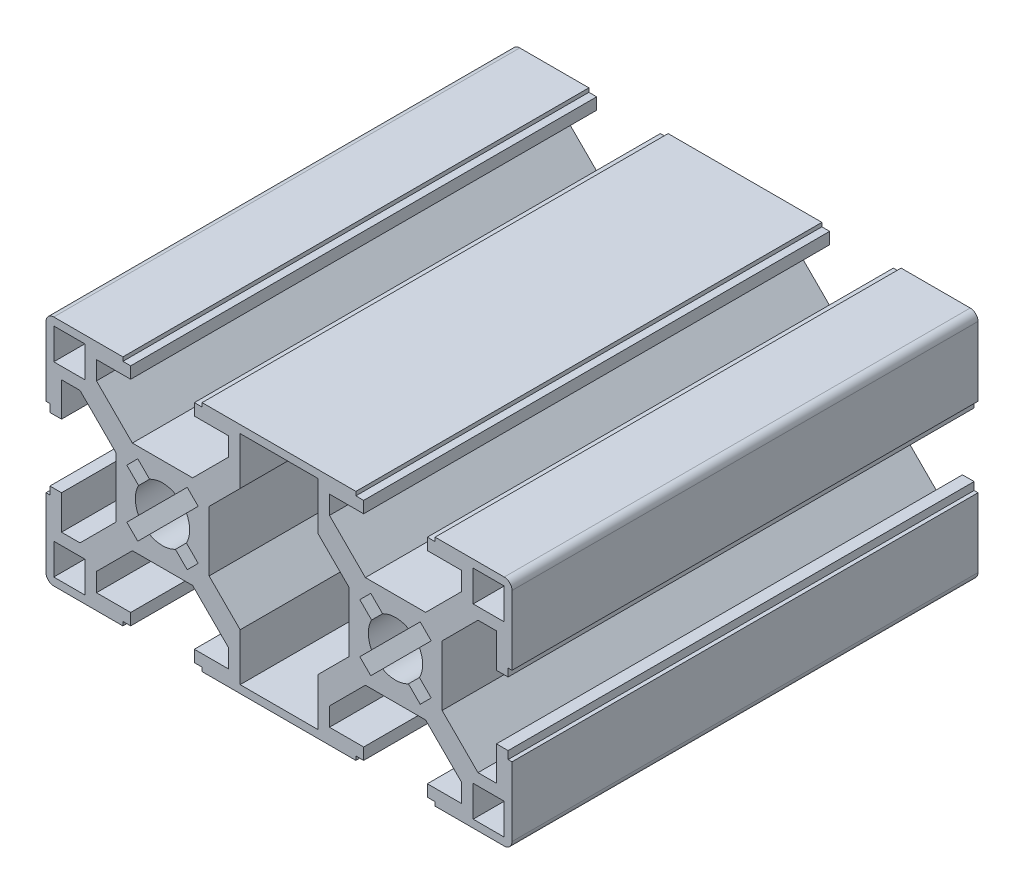
from build123d import *

# Parameters (mm, degrees)
ESBO_O1_W                      = 4
ESBO_O1_H                      = 4
RESSALTO_EXTRUS_O1_DEPTH       = 60
PADR_OCIRCULAR1_COUNT          = 4
PADR_O_LINEAR1_COUNT           = 2
PADR_O_LINEAR1_PITCH           = 30
PADR_O_LINEAR1_COPY_1_SKETCH_W = 4
PADR_O_LINEAR1_COPY_1_SKETCH_H = 4
PADR_O_LINEAR1_COPY_1_DEPTH    = 60
PADR_O_LINEAR1_COPY_2_SKETCH_W = 4
PADR_O_LINEAR1_COPY_2_SKETCH_H = 4
PADR_O_LINEAR1_COPY_2_DEPTH    = 60
PADR_O_LINEAR1_COPY_3_SKETCH_W = 4
PADR_O_LINEAR1_COPY_3_SKETCH_H = 4
PADR_O_LINEAR1_COPY_3_DEPTH    = 60
ESBO_O4_W                      = 10
ESBO_O4_H                      = 28
CORTE_EXTRUS_O1_DEPTH          = 77.485292704
FILETE1_R                      = 1


with BuildPart() as part:
    # Esboço1 → Ressalto-extrusão1 (new body)
    with BuildSketch(Plane.XY):
        with BuildLine():
            ThreePointArc((-1.664601464, 3.078815026), (-0.858529967, 3.393070335), (0, 3.5))
            Line((0, 3.5), (0, 6))
            Line((0, 6), (-3.878679656, 6))
            Line((-3.878679656, 6), (-8.5, 10.621320344))
            Line((-8.5, 10.621320344), (-8.5, 13))
            Line((-8.5, 13), (-4.1, 13))
            Line((-4.1, 13), (-4.1, 14.5))
            Line((-4.1, 14.5), (-5.1, 14.5))
            Line((-5.1, 14.5), (-5.1, 15))
            Line((-5.1, 15), (-15, 15))
            Line((-15, 15), (-15, 5.1))
            Line((-15, 5.1), (-14.5, 5.1))
            Line((-14.5, 5.1), (-14.5, 4.1))
            Line((-14.5, 4.1), (-13, 4.1))
            Line((-13, 4.1), (-13, 8.5))
            Line((-13, 8.5), (-10.621320344, 8.5))
            Line((-10.621320344, 8.5), (-6, 3.878679656))
            Line((-6, 3.878679656), (-6, 0))
            Line((-6, 0), (-3.5, 0))
            ThreePointArc((-3.5, 0), (-3.393070335, 0.858529967), (-3.078815026, 1.664601464))
            Line((-3.078815026, 1.664601464), (-4.596194078, 3.181980515))
            Line((-4.596194078, 3.181980515), (-3.181980515, 4.596194078))
            Line((-3.181980515, 4.596194078), (-1.664601464, 3.078815026))
        make_face()
        with Locations((-12, 12)):
            Rectangle(ESBO_O1_W, ESBO_O1_H, mode=Mode.SUBTRACT)
    ressalto_extrus_o1 = extrude(amount=RESSALTO_EXTRUS_O1_DEPTH)

    # PadrãoCircular1: Ressalto-extrusão1 ×4 about axis
    padr_ocircular1_axis = Axis((0, 0, 0), (0, 0, 1))
    for i in range(1, PADR_OCIRCULAR1_COUNT):
        add(ressalto_extrus_o1.rotate(padr_ocircular1_axis, i * 360 / PADR_OCIRCULAR1_COUNT))

    # Padrão linear1: Ressalto-extrusão1 ×2
    with Locations(*[(i * PADR_O_LINEAR1_PITCH, 0, 0) for i in range(1, PADR_O_LINEAR1_COUNT)]):
        add(ressalto_extrus_o1)

    # Padrão linear1 copy 1 sketch → Padrão linear1 copy 1 (add)
    with BuildSketch(Plane(origin=(30, 0, 0), x_dir=(0, 1, 0), z_dir=(0, 0, 1))):
        with BuildLine():
            ThreePointArc((-1.664601464, 3.078815026), (-0.858529967, 3.393070335), (0, 3.5))
            Line((0, 3.5), (0, 6))
            Line((0, 6), (-3.878679656, 6))
            Line((-3.878679656, 6), (-8.5, 10.621320344))
            Line((-8.5, 10.621320344), (-8.5, 13))
            Line((-8.5, 13), (-4.1, 13))
            Line((-4.1, 13), (-4.1, 14.5))
            Line((-4.1, 14.5), (-5.1, 14.5))
            Line((-5.1, 14.5), (-5.1, 15))
            Line((-5.1, 15), (-15, 15))
            Line((-15, 15), (-15, 5.1))
            Line((-15, 5.1), (-14.5, 5.1))
            Line((-14.5, 5.1), (-14.5, 4.1))
            Line((-14.5, 4.1), (-13, 4.1))
            Line((-13, 4.1), (-13, 8.5))
            Line((-13, 8.5), (-10.621320344, 8.5))
            Line((-10.621320344, 8.5), (-6, 3.878679656))
            Line((-6, 3.878679656), (-6, 0))
            Line((-6, 0), (-3.5, 0))
            ThreePointArc((-3.5, 0), (-3.393070335, 0.858529967), (-3.078815026, 1.664601464))
            Line((-3.078815026, 1.664601464), (-4.596194078, 3.181980515))
            Line((-4.596194078, 3.181980515), (-3.181980515, 4.596194078))
            Line((-3.181980515, 4.596194078), (-1.664601464, 3.078815026))
        make_face()
        with Locations((-12, 12)):
            Rectangle(PADR_O_LINEAR1_COPY_1_SKETCH_W, PADR_O_LINEAR1_COPY_1_SKETCH_H, mode=Mode.SUBTRACT)
    extrude(amount=PADR_O_LINEAR1_COPY_1_DEPTH)

    # Padrão linear1 copy 2 sketch → Padrão linear1 copy 2 (add)
    with BuildSketch(Plane(origin=(30, 0, 0), x_dir=(-1, 0, 0), z_dir=(0, 0, 1))):
        with BuildLine():
            ThreePointArc((-1.664601464, 3.078815026), (-0.858529967, 3.393070335), (0, 3.5))
            Line((0, 3.5), (0, 6))
            Line((0, 6), (-3.878679656, 6))
            Line((-3.878679656, 6), (-8.5, 10.621320344))
            Line((-8.5, 10.621320344), (-8.5, 13))
            Line((-8.5, 13), (-4.1, 13))
            Line((-4.1, 13), (-4.1, 14.5))
            Line((-4.1, 14.5), (-5.1, 14.5))
            Line((-5.1, 14.5), (-5.1, 15))
            Line((-5.1, 15), (-15, 15))
            Line((-15, 15), (-15, 5.1))
            Line((-15, 5.1), (-14.5, 5.1))
            Line((-14.5, 5.1), (-14.5, 4.1))
            Line((-14.5, 4.1), (-13, 4.1))
            Line((-13, 4.1), (-13, 8.5))
            Line((-13, 8.5), (-10.621320344, 8.5))
            Line((-10.621320344, 8.5), (-6, 3.878679656))
            Line((-6, 3.878679656), (-6, 0))
            Line((-6, 0), (-3.5, 0))
            ThreePointArc((-3.5, 0), (-3.393070335, 0.858529967), (-3.078815026, 1.664601464))
            Line((-3.078815026, 1.664601464), (-4.596194078, 3.181980515))
            Line((-4.596194078, 3.181980515), (-3.181980515, 4.596194078))
            Line((-3.181980515, 4.596194078), (-1.664601464, 3.078815026))
        make_face()
        with Locations((-12, 12)):
            Rectangle(PADR_O_LINEAR1_COPY_2_SKETCH_W, PADR_O_LINEAR1_COPY_2_SKETCH_H, mode=Mode.SUBTRACT)
    extrude(amount=PADR_O_LINEAR1_COPY_2_DEPTH)

    # Padrão linear1 copy 3 sketch → Padrão linear1 copy 3 (add)
    with BuildSketch(Plane(origin=(30, 0, 0), x_dir=(0, -1, 0), z_dir=(0, 0, 1))):
        with BuildLine():
            ThreePointArc((-1.664601464, 3.078815026), (-0.858529967, 3.393070335), (0, 3.5))
            Line((0, 3.5), (0, 6))
            Line((0, 6), (-3.878679656, 6))
            Line((-3.878679656, 6), (-8.5, 10.621320344))
            Line((-8.5, 10.621320344), (-8.5, 13))
            Line((-8.5, 13), (-4.1, 13))
            Line((-4.1, 13), (-4.1, 14.5))
            Line((-4.1, 14.5), (-5.1, 14.5))
            Line((-5.1, 14.5), (-5.1, 15))
            Line((-5.1, 15), (-15, 15))
            Line((-15, 15), (-15, 5.1))
            Line((-15, 5.1), (-14.5, 5.1))
            Line((-14.5, 5.1), (-14.5, 4.1))
            Line((-14.5, 4.1), (-13, 4.1))
            Line((-13, 4.1), (-13, 8.5))
            Line((-13, 8.5), (-10.621320344, 8.5))
            Line((-10.621320344, 8.5), (-6, 3.878679656))
            Line((-6, 3.878679656), (-6, 0))
            Line((-6, 0), (-3.5, 0))
            ThreePointArc((-3.5, 0), (-3.393070335, 0.858529967), (-3.078815026, 1.664601464))
            Line((-3.078815026, 1.664601464), (-4.596194078, 3.181980515))
            Line((-4.596194078, 3.181980515), (-3.181980515, 4.596194078))
            Line((-3.181980515, 4.596194078), (-1.664601464, 3.078815026))
        make_face()
        with Locations((-12, 12)):
            Rectangle(PADR_O_LINEAR1_COPY_3_SKETCH_W, PADR_O_LINEAR1_COPY_3_SKETCH_H, mode=Mode.SUBTRACT)
    extrude(amount=PADR_O_LINEAR1_COPY_3_DEPTH)

    # Esboço4 → Corte-extrusão1 (cut, through all)
    with BuildSketch(Plane(origin=(0, 0, 0), x_dir=(-1, 0, 0), z_dir=(0, 0, -1))):
        with Locations((-15, 0)):
            Rectangle(ESBO_O4_W, ESBO_O4_H)
    extrude(amount=-CORTE_EXTRUS_O1_DEPTH, mode=Mode.SUBTRACT)

    # Filete1
    filete1_edges = [part.edges().sort_by_distance(p)[0] for p in [
        (45, -15, 30),
        (45, 15, 30),
        (-15, 15, 30),
        (-15, -15, 30),
    ]]
    fillet(filete1_edges, radius=FILETE1_R)


solid = part.part
